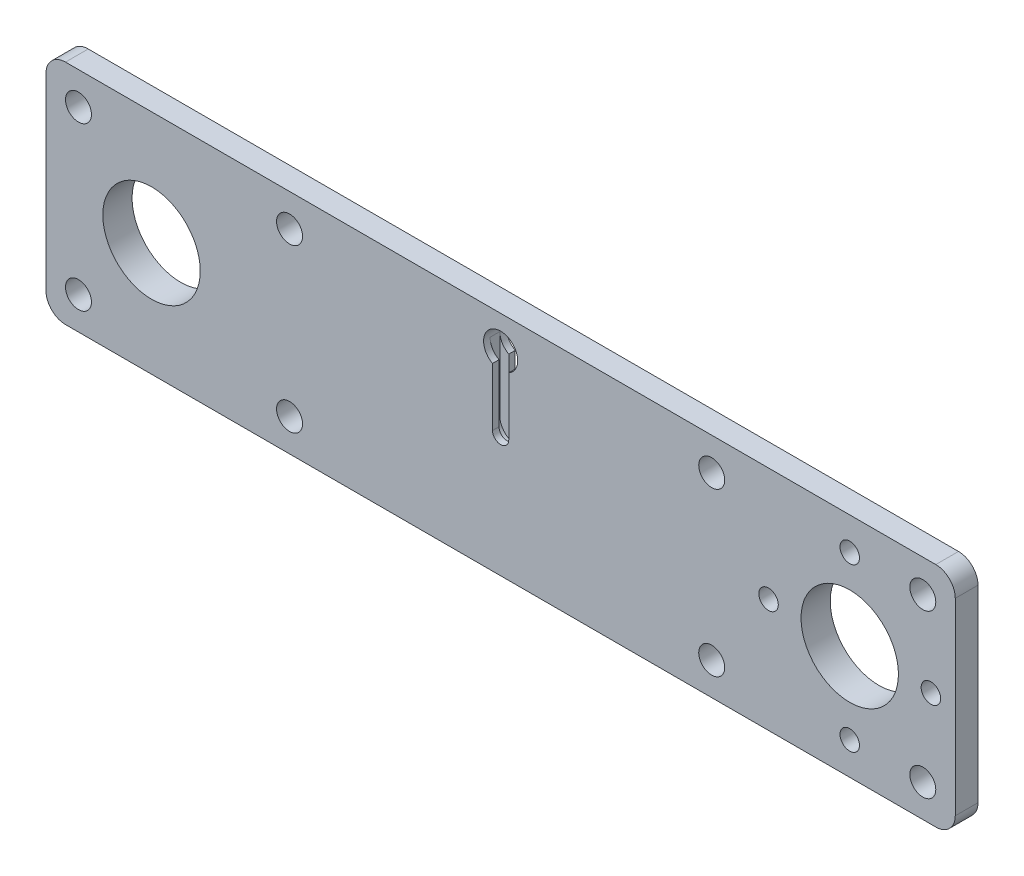
from build123d import *

# Parameters (mm, degrees)
SKETCH1_W           = 280
SKETCH1_H           = 70
BOSS_EXTRUDE1_DEPTH = 7
FILLET1_R           = 6
SKETCH2_R           = 15
SKETCH2_R_2         = 4
SKETCH2_R_3         = 3
CUT_EXTRUDE1_DEPTH  = 10
BOSS_EXTRUDE2_START = 2
SKETCH3_R           = 20
SKETCH3_R_2         = 15
BOSS_EXTRUDE2_DEPTH = 2
CUT_EXTRUDE2_DEPTH  = 3


with BuildPart() as part:
    # Sketch1 → Boss-Extrude1 (new body)
    with BuildSketch(Plane.XY):
        Rectangle(SKETCH1_W, SKETCH1_H)
    extrude(amount=BOSS_EXTRUDE1_DEPTH)

    # Fillet1
    fillet1_edges = [part.edges().sort_by_distance(p)[0] for p in [
        (140, -35, 3.5),
        (-140, -35, 3.5),
        (-140, 35, 3.5),
        (140, 35, 3.5),
    ]]
    fillet(fillet1_edges, radius=FILLET1_R)

    # Sketch2 → Cut-Extrude1 (cut)
    with BuildSketch(Plane(origin=(0, 0, 0), x_dir=(-1, 0, 0), z_dir=(0, 0, -1))):
        with Locations((-107.5, 0)):
            Circle(SKETCH2_R)
        with Locations((107.5, 0)):
            Circle(SKETCH2_R)
        with Locations((130, 25)):
            Circle(SKETCH2_R_2)
        with Locations((65, 25)):
            Circle(SKETCH2_R_2)
        with Locations((-65, 25)):
            Circle(SKETCH2_R_2)
        with Locations((-130, 25)):
            Circle(SKETCH2_R_2)
        with Locations(Location((-130, -25, 0), (0, 0, 180))):
            Circle(SKETCH2_R_2)
        with Locations(Location((-65, -25, 0), (0, 0, 180))):
            Circle(SKETCH2_R_2)
        with Locations(Location((65, -25, 0), (0, 0, 180))):
            Circle(SKETCH2_R_2)
        with Locations(Location((130, -25, 0), (0, 0, 180))):
            Circle(SKETCH2_R_2)
        with Locations((-132.5, 0)):
            Circle(SKETCH2_R_3)
        with Locations((-107.5, 25)):
            Circle(SKETCH2_R_3)
        with Locations((-107.5, -25)):
            Circle(SKETCH2_R_3)
        with Locations((-82.5, 0)):
            Circle(SKETCH2_R_3)
        with BuildLine():
            Line((2.5, 20.383453672), (2.5, 2.5))
            ThreePointArc((2.5, 2.5), (0, 0), (-2.5, 2.5))
            Line((-2.5, 2.5), (-2.5, 20.383453672))
            ThreePointArc((-2.5, 20.383453672), (0, 30.25), (2.5, 20.383453672))
        make_face()
    extrude(amount=-CUT_EXTRUDE1_DEPTH, mode=Mode.SUBTRACT)

    # Sketch3 → Boss-Extrude2 (add)
    # profile 1 of 2: a face of its own
    with BuildSketch(Plane(origin=(0, 0, 0), x_dir=(-1, 0, 0), z_dir=(0, 0, -1)).offset(BOSS_EXTRUDE2_START)):
        with Locations(Location((-107.5, 0, 0), (0, 0, 180))):
            Circle(SKETCH3_R)
        with Locations((-107.5, 0)):
            Circle(SKETCH3_R_2, mode=Mode.SUBTRACT)
    # profile 2 of 2: a face of its own
    with BuildSketch(Plane(origin=(0, 0, 0), x_dir=(-1, 0, 0), z_dir=(0, 0, -1)).offset(BOSS_EXTRUDE2_START)):
        with Locations(Location((107.5, 0, 0), (0, 0, 180))):
            Circle(SKETCH3_R)
        with Locations((107.5, 0)):
            Circle(SKETCH3_R_2, mode=Mode.SUBTRACT)
    extrude(amount=-BOSS_EXTRUDE2_DEPTH)

    # Sketch4 → Cut-Extrude2 (cut)
    with BuildSketch(Plane.XY.offset(5)):
        with BuildLine():
            Line((-5.25, 20.383453672), (-5.25, 25))
            Line((-5.25, 25), (0, 25))
            Line((0, 25), (5.25, 25))
            Line((5.25, 25), (5.25, 20.383453672))
            Line((5.25, 20.383453672), (5.25, 2.5))
            ThreePointArc((5.25, 2.5), (0, -2.75), (-5.25, 2.5))
            Line((-5.25, 2.5), (-5.25, 20.383453672))
        make_face()
    extrude(amount=-CUT_EXTRUDE2_DEPTH, mode=Mode.SUBTRACT)


solid = part.part
